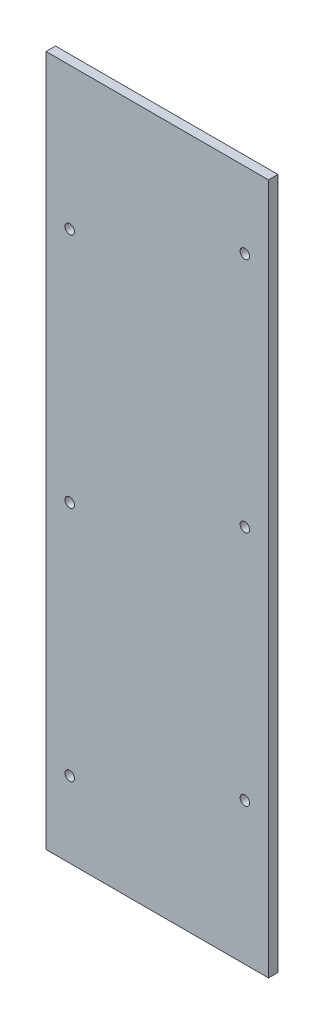
from build123d import *

# Parameters (mm, degrees)
SKETCH1_W           = 94
SKETCH1_H           = 292
BOSS_EXTRUDE1_DEPTH = 4
SKETCH2_R           = 2
CUT_EXTRUDE1_DEPTH  = 4


with BuildPart() as part:
    # Sketch1 → Boss-Extrude1 (new body)
    with BuildSketch(Plane.XY):
        Rectangle(SKETCH1_W, SKETCH1_H)
    extrude(amount=BOSS_EXTRUDE1_DEPTH)

    # Sketch2 → Cut-Extrude1 (cut)
    with BuildSketch(Plane.XY.offset(4)):
        with Locations((-37, -14)):
            Circle(SKETCH2_R)
        with Locations((-37, 86)):
            Circle(SKETCH2_R)
        with Locations((-37, -114)):
            Circle(SKETCH2_R)
        with Locations((37, -86)):
            Circle(SKETCH2_R)
        with Locations((37, 14)):
            Circle(SKETCH2_R)
        with Locations((37, 114)):
            Circle(SKETCH2_R)
    extrude(amount=-CUT_EXTRUDE1_DEPTH, mode=Mode.SUBTRACT)


solid = part.part
